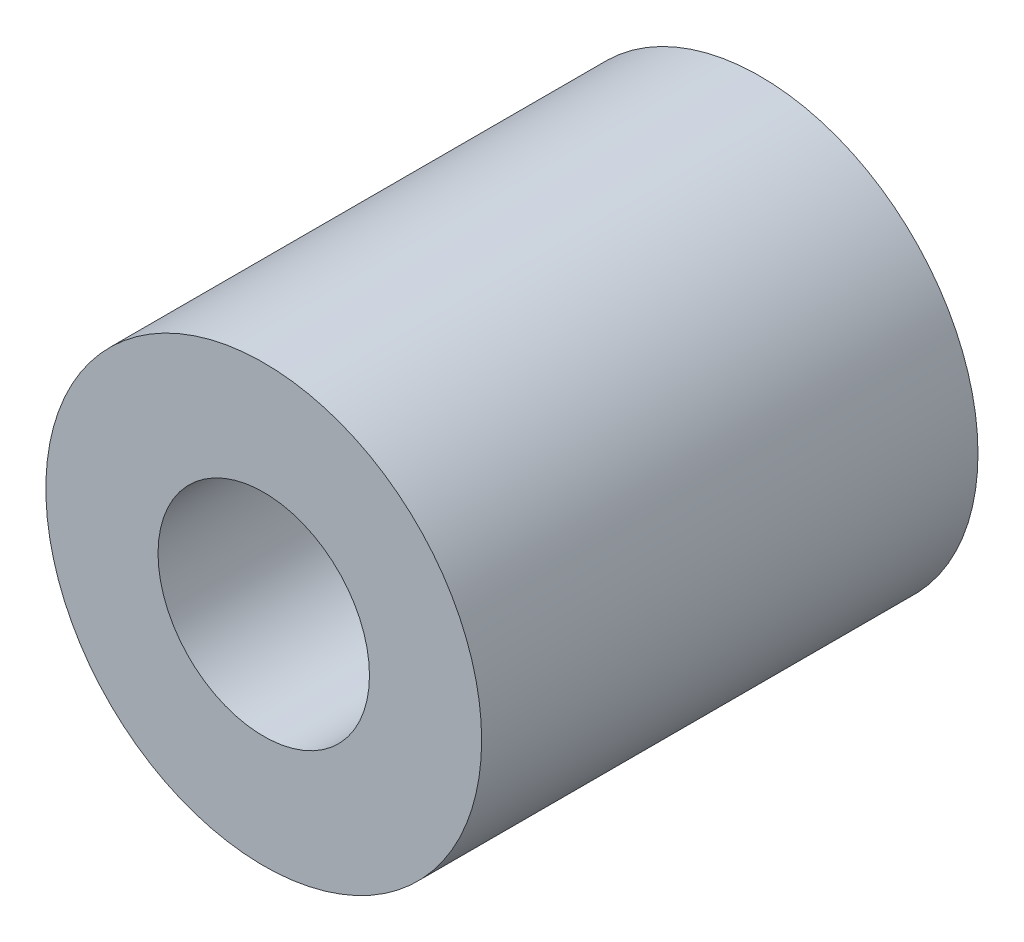
from build123d import *

# Parameters (mm, degrees)
SKETCH1_R                 = 2.78765
BOSS_EXTRUDE1_DEPTH       = 6.35
F_6_32_TAPPED_HOLE1_D     = 2.7051
F_6_32_TAPPED_HOLE1_DEPTH = 9.398
F_6_32_TAPPED_HOLE1_TIP   = 0.81269403


with BuildPart() as part:
    # Sketch1 → Boss-Extrude1 (new body)
    with BuildSketch(Plane.XY):
        Circle(SKETCH1_R)
    extrude(amount=BOSS_EXTRUDE1_DEPTH)

    # #6-32 Tapped Hole1
    with Locations(Plane(origin=(0, 0, 0), x_dir=(-1, 0, 0), z_dir=(0, 0, -1))):
        with Locations((0, 0)):
            Hole(F_6_32_TAPPED_HOLE1_D / 2, depth=F_6_32_TAPPED_HOLE1_DEPTH)
            with Locations((0, 0, -(F_6_32_TAPPED_HOLE1_DEPTH + F_6_32_TAPPED_HOLE1_TIP / 2))):  # 118° drill point
                Cone(0, F_6_32_TAPPED_HOLE1_D / 2, F_6_32_TAPPED_HOLE1_TIP, mode=Mode.SUBTRACT)


solid = part.part
